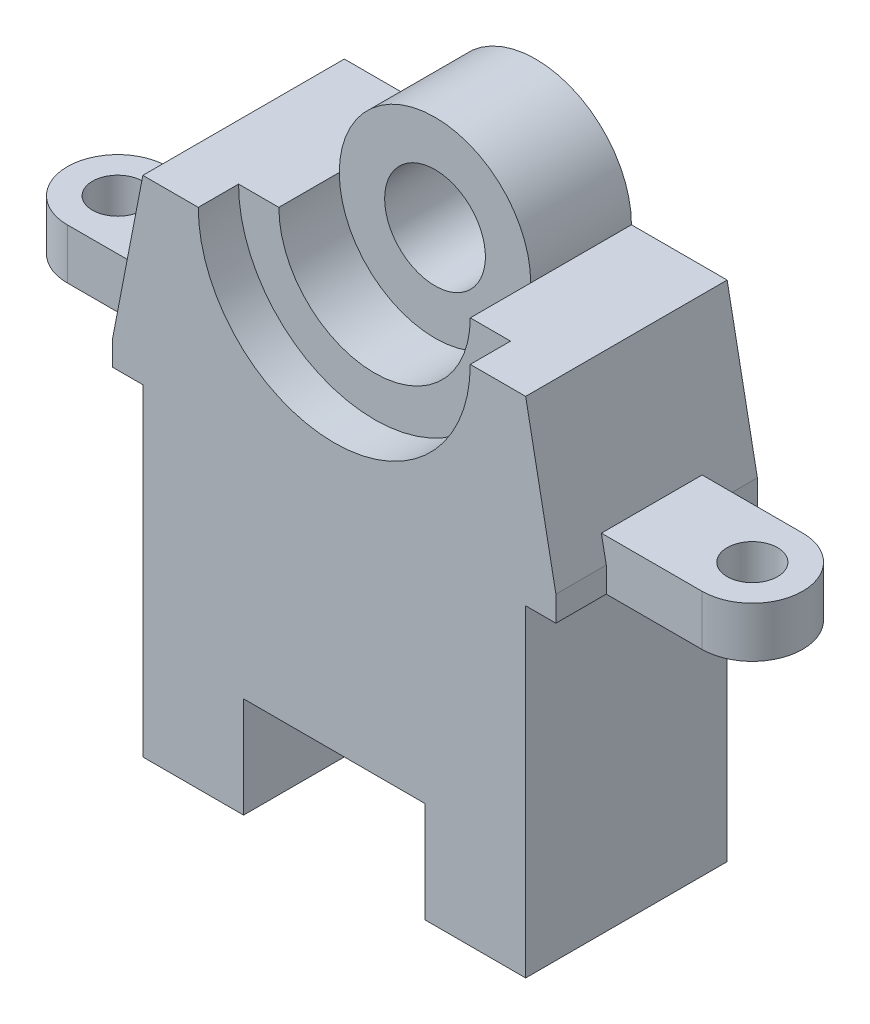
from build123d import *

# Parameters (mm, degrees)
BOSS_EXTRUDE1_DEPTH = 40
CUT_EXTRUDE1_DEPTH  = 8
CUT_EXTRUDE2_DEPTH  = 134.221619867
BOSS_EXTRUDE2_START = -20
SKETCH5_R           = 19
SKETCH5_R_2         = 10
BOSS_EXTRUDE2_DEPTH = 20
SKETCH6_R           = 5
BOSS_EXTRUDE3_DEPTH = 10
SKETCH7_R           = 5
BOSS_EXTRUDE4_DEPTH = 10


with BuildPart() as part:
    # Sketch1 → Boss-Extrude1 (new body)
    with BuildSketch(Plane.XY):
        Polygon((0, 0), (20, 0), (20, 20), (56, 20), (56, 0), (76, 0), (76, 64), (82, 64), (82, 69), (76, 100), (0, 100), (-6, 69), (-6, 64), (0, 64), align=None)
    extrude(amount=BOSS_EXTRUDE1_DEPTH)

    # Sketch2 → Cut-Extrude1 (cut)
    with BuildSketch(Plane.XY.offset(40)):
        with BuildLine():
            Line((11, 100), (65, 100))
            ThreePointArc((65, 100), (38, 73), (11, 100))
        make_face()
    extrude(amount=-CUT_EXTRUDE1_DEPTH, mode=Mode.SUBTRACT)

    # Sketch4 → Cut-Extrude2 (cut, through all)
    with BuildSketch(Plane.XY.offset(32)):
        with BuildLine():
            Line((19, 100), (57, 100))
            ThreePointArc((57, 100), (38, 81), (19, 100))
        make_face()
    extrude(amount=-CUT_EXTRUDE2_DEPTH, mode=Mode.SUBTRACT)

    # Sketch5 → Boss-Extrude2 (add)
    with BuildSketch(Plane(origin=(0, 0, 0), x_dir=(-1, 0, 0), z_dir=(0, 0, -1)).offset(BOSS_EXTRUDE2_START)):
        with Locations((-38, 100)):
            Circle(SKETCH5_R)
        with Locations((-38, 100)):
            Circle(SKETCH5_R_2, mode=Mode.SUBTRACT)
    extrude(amount=BOSS_EXTRUDE2_DEPTH)

    # Sketch6 → Boss-Extrude3 (add)
    with BuildSketch(Plane.XZ.offset(-64)):
        with BuildLine():
            Line((-3.1710474, 30), (-3.1710474, 10))
            Line((-3.1710474, 10), (-25, 10))
            ThreePointArc((-25, 10), (-35, 20), (-25, 30))
            Line((-25, 30), (-3.1710474, 30))
        make_face()
        with Locations(Location((-25, 20, 0), (0, 0, 270))):
            Circle(SKETCH6_R, mode=Mode.SUBTRACT)
    extrude(amount=-BOSS_EXTRUDE3_DEPTH)

    # Sketch7 → Boss-Extrude4 (add)
    with BuildSketch(Plane.XZ.offset(-64)):
        with BuildLine():
            Line((78.953464746, 30), (78.953464746, 10))
            Line((78.953464746, 10), (101, 10))
            ThreePointArc((101, 10), (111, 20), (101, 30))
            Line((101, 30), (78.953464746, 30))
        make_face()
        with Locations(Location((101, 20, 0), (0, 0, 270))):
            Circle(SKETCH7_R, mode=Mode.SUBTRACT)
    extrude(amount=-BOSS_EXTRUDE4_DEPTH)


solid = part.part
